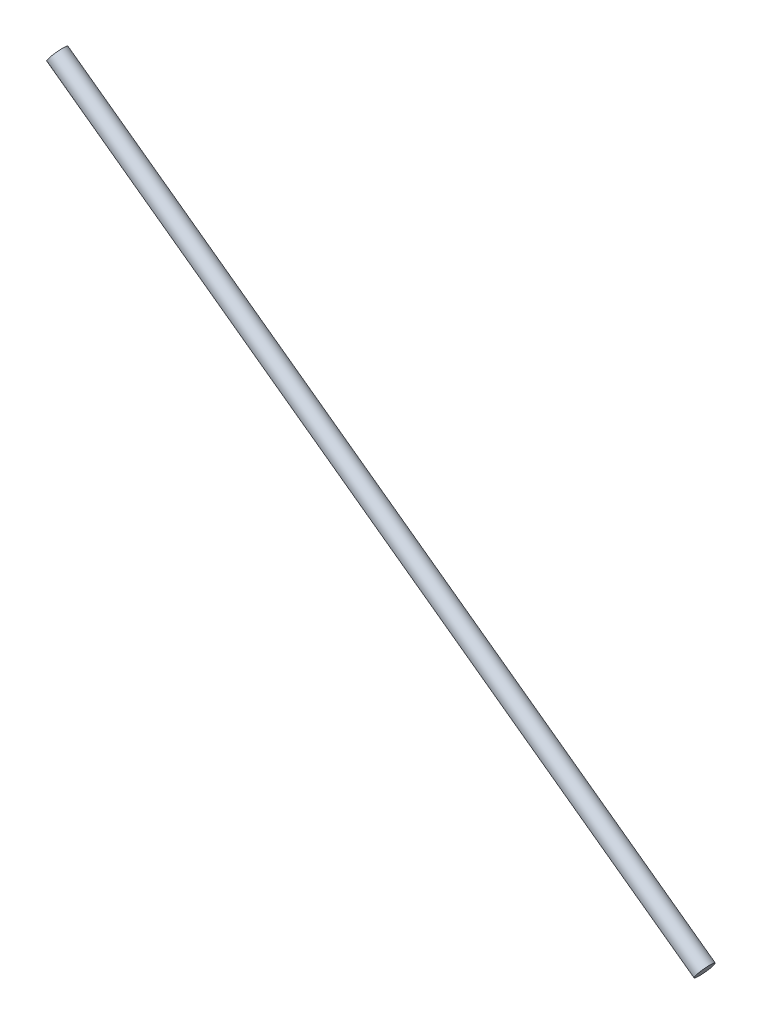
from build123d import *

# Parameters (mm, degrees)
SKETCH3_R = 1.5


with BuildPart() as part:
    # Sweep1: sweep along a path in Sketch2
    with BuildLine(Plane.XY) as sweep1_path:
        Line((178.792755757, 134.602822775), (72.764891712, 211.636575157))
    # Sketch3 → Sweep1 (sweep)
    with BuildSketch(Plane(origin=(72.764891712, 211.636575157, 0), x_dir=(0, 0, 1), z_dir=(-0.8090169943749471, 0.5877852522924736, 0))):
        Circle(SKETCH3_R)
    sweep(path=sweep1_path.line)


solid = part.part
